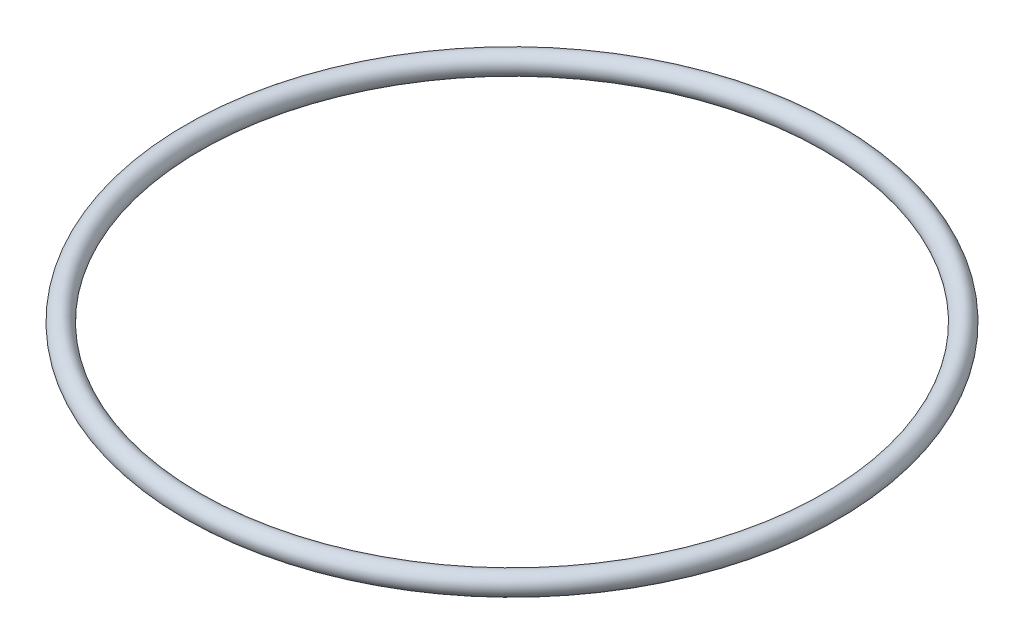
from build123d import *

# Parameters (mm, degrees)
ESBO_O1_R = 1.765


with BuildPart() as part:
    # Esboço1 → Revolução1 (revolve)
    with BuildSketch(Plane.XY, mode=Mode.PRIVATE) as revolu_o1_sk:
        with Locations((-53.95, 0)):
            Circle(ESBO_O1_R)
    revolve(revolu_o1_sk.sketch.rotate(Axis((0, 0, 0), (0, 1, 0)), 270), axis=Axis((0, 0, 0), (0, 1, 0)))


solid = part.part
